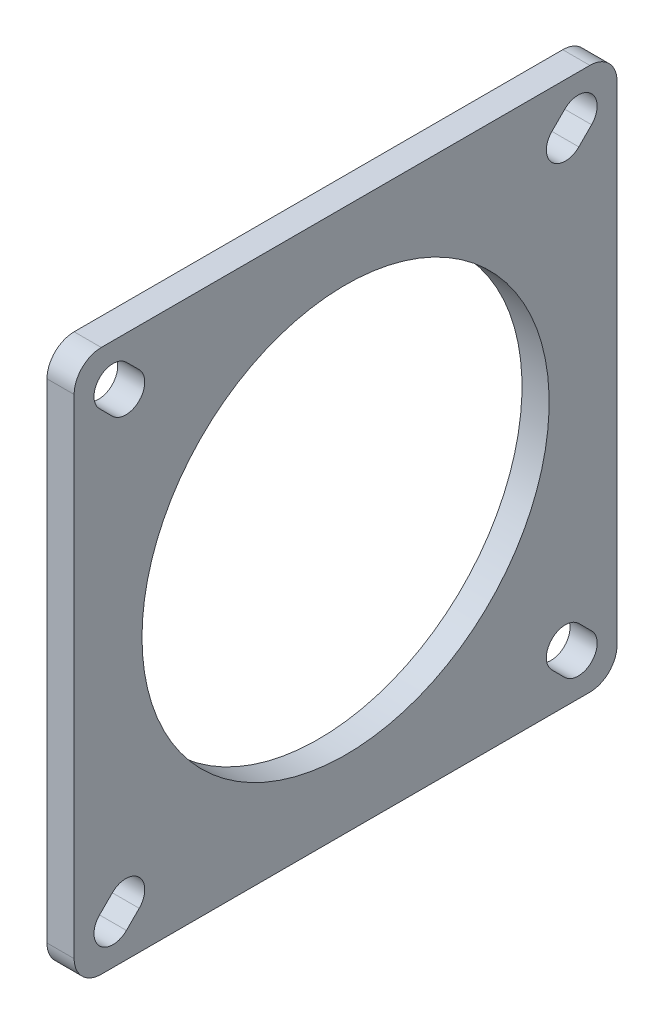
from build123d import *

# Parameters (mm, degrees)
SKETCH_1_W               = 3
SKETCH_1_H               = 27.5
CUT_EXTRUDE_4_DEPTH      = 71.774289117
CUT_EXTRUDE_4_DEPTH_BACK = 71.774289117
SKETCH_7_R               = 50
SKETCH_7_W               = 60
SKETCH_7_H               = 60
CUT_EXTRUDE_3_DEPTH      = 43.532340636
PATTERN_CIRCULAR_2_COUNT = 4
FILLET_1_R               = 3


with BuildPart() as part:
    # Эскиз1 → Повернуть1 (revolve)
    with BuildSketch(Plane.XY, mode=Mode.PRIVATE) as revolve_1_sk:
        with Locations((1.5, 36.25)):
            Rectangle(SKETCH_1_W, SKETCH_1_H)
    revolve(revolve_1_sk.sketch.rotate(Axis((-29.36512031, 0, 0), (1, 0, 0)), 90), axis=Axis((-29.36512031, 0, 0), (1, 0, 0)))

    # Эскиз7 → Вырез-Вытянуть4 (cut, two sides: drawn at the far end of the back side and taken through both)
    with BuildSketch(Plane.ZY.offset(-CUT_EXTRUDE_4_DEPTH_BACK)):
        Circle(SKETCH_7_R)
        Rectangle(SKETCH_7_W, SKETCH_7_H, mode=Mode.SUBTRACT)
    extrude(amount=CUT_EXTRUDE_4_DEPTH + CUT_EXTRUDE_4_DEPTH_BACK, mode=Mode.SUBTRACT)

    # Эскиз6 → Вырез-Вытянуть3 (cut, symmetric)
    with BuildSketch(Plane.ZY):
        with BuildLine():
            Line((-27.192031022, 24.222182541), (-25.777817459, 22.807968978))
            ThreePointArc((-25.777817459, 22.807968978), (-22.807968978, 22.807968978), (-22.807968978, 25.777817459))
            Line((-22.807968978, 25.777817459), (-24.222182541, 27.192031022))
            ThreePointArc((-24.222182541, 27.192031022), (-27.192031022, 27.192031022), (-27.192031022, 24.222182541))
        make_face()
    cut_extrude_3 = extrude(amount=CUT_EXTRUDE_3_DEPTH, both=True, mode=Mode.SUBTRACT)

    # Круговой массив2: Вырез-Вытянуть3 ×4 about axis
    pattern_circular_2_axis = Axis((0, 0, 0), (1, 0, 0))
    for i in range(1, PATTERN_CIRCULAR_2_COUNT):
        add(cut_extrude_3.rotate(pattern_circular_2_axis, i * 360 / PATTERN_CIRCULAR_2_COUNT), mode=Mode.SUBTRACT)

    # Скругление1
    fillet_1_edges = [part.edges().sort_by_distance(p)[0] for p in [
        (1.5, 30, -30),
        (1.5, 30, 30),
        (1.5, -30, 30),
        (1.5, -30, -30),
    ]]
    fillet(fillet_1_edges, radius=FILLET_1_R)


solid = part.part
